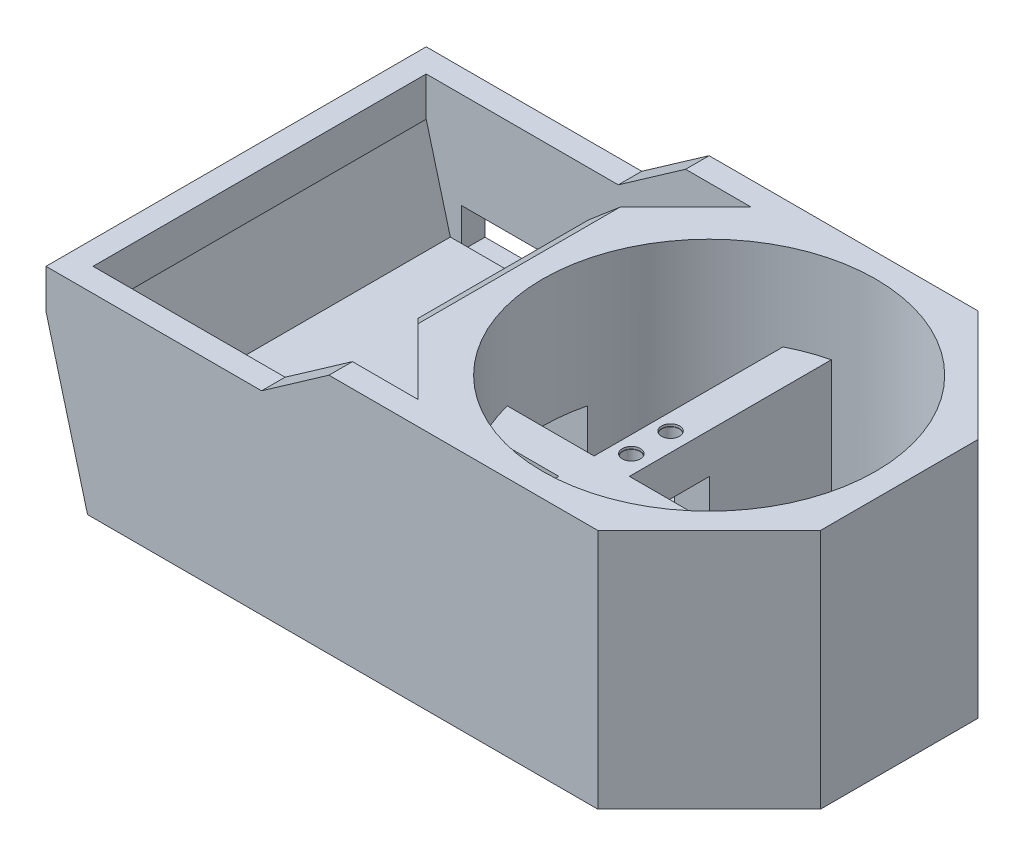
from build123d import *

# Parameters (mm, degrees)
BOSS_EXTRUDE1_DEPTH                          = 61.6
BOSS_EXTRUDE3_DEPTH                          = 97.007351
SKETCH3_R                                    = 42.5
CUT_EXTRUDE1_DEPTH                           = 53.5
BOSS_EXTRUDE2_START                          = 8.1
BOSS_EXTRUDE2_DEPTH                          = 31.22
CBORE_FOR_M5_HEX_HEAD_CAP_SCREW1_D           = 4.4
CBORE_FOR_M5_HEX_HEAD_CAP_SCREW1_DEPTH       = 5.5
CBORE_FOR_M5_HEX_HEAD_CAP_SCREW1_CBORE_D     = 4.6
CBORE_FOR_M5_HEX_HEAD_CAP_SCREW1_CBORE_DEPTH = 0.6
CBORE_FOR_M5_HEX_HEAD_CAP_SCREW1_TIP         = 1.321893362
CUT_EXTRUDE3_DEPTH                           = 45
BOSS_EXTRUDE4_REACH                          = 168.648
CUT_EXTRUDE2_REACH                           = 130.328
SKETCH6_W                                    = 20.5
SKETCH6_H                                    = 21
CUT_EXTRUDE2_DIRECTION_2_DEPTH               = 40
SKETCH13_W                                   = 20
SKETCH13_H                                   = 10
CUT_EXTRUDE4_DEPTH                           = 6


with BuildPart() as part:
    # Sketch1 → Boss-Extrude1 (new body)
    with BuildSketch(Plane(origin=(0, 0, 0), x_dir=(1, 0, 0), z_dir=(0, 1, 0))):
        Polygon((-48.503675457, 20.090880199), (-48.503675457, -20.090880199), (-20.090880199, -48.503675457), (20.090880199, -48.503675457), (48.503675457, -20.090880199), (48.503675457, 20.090880199), (20.090880199, 48.503675457), (-20.090880199, 48.503675457), align=None)
    extrude(amount=BOSS_EXTRUDE1_DEPTH)

    # Sketch10 → Boss-Extrude3 (add, through all)
    with BuildSketch(Plane.XY.offset(48.503675457)):
        Polygon((-20.090880199, 0), (-110.090880199, 0), (-120.692155197, 39.564496916), (-120.692155197, 49.564496916), (-65.692155197, 49.564496916), (-48.503675457, 61.6), (-20.090880199, 61.6), align=None)
    extrude(amount=-BOSS_EXTRUDE3_DEPTH)

    # Sketch3 → Cut-Extrude1 (cut)
    with BuildSketch(Plane(origin=(0, 61.6, 0), x_dir=(1, 0, 0), z_dir=(0, 1, 0))):
        with Locations(Location((0, 0, 0), (0, 0, 270))):
            Circle(SKETCH3_R)
    extrude(amount=-CUT_EXTRUDE1_DEPTH, mode=Mode.SUBTRACT)

    # Sketch5 → Boss-Extrude2 (add)
    with BuildSketch(Plane(origin=(0, 0, 0), x_dir=(1, 0, 0), z_dir=(0, 1, 0)).offset(BOSS_EXTRUDE2_START)):
        Polygon((41.245454295, -10.25), (38.9, -10.25), (38.9, 29.694555656), (29.9, 29.694555656), (29.9, -10.25), (-10.1, -10.25), (-10.1, 41.282441788), (-19.1, 41.282441788), (-19.1, -10.25), (-41.245454295, -10.25), (-41.245454295, -19.25), (-19.1, -19.25), (-19.1, -41.282441788), (-10.1, -41.282441788), (-10.1, -19.25), (29.9, -19.25), (29.9, -29.694555656), (38.9, -29.694555656), (38.9, -19.25), (41.245454295, -19.25), align=None)
    extrude(amount=BOSS_EXTRUDE2_DEPTH)

    # CBORE for M5 Hex Head Cap Screw1
    with Locations(Plane(origin=(0, 39.32, 0), x_dir=(1, 0, 0), z_dir=(0, 1, 0))):
        with Locations((-14.85, -5), (-14.85, 5), (34.65, 5), (34.65, -5)):
            CounterBoreHole(CBORE_FOR_M5_HEX_HEAD_CAP_SCREW1_D / 2, CBORE_FOR_M5_HEX_HEAD_CAP_SCREW1_CBORE_D / 2, CBORE_FOR_M5_HEX_HEAD_CAP_SCREW1_CBORE_DEPTH, depth=CBORE_FOR_M5_HEX_HEAD_CAP_SCREW1_DEPTH)
            with Locations((0, 0, -(CBORE_FOR_M5_HEX_HEAD_CAP_SCREW1_DEPTH + CBORE_FOR_M5_HEX_HEAD_CAP_SCREW1_TIP / 2))):  # 118° drill point
                Cone(0, CBORE_FOR_M5_HEX_HEAD_CAP_SCREW1_D / 2, CBORE_FOR_M5_HEX_HEAD_CAP_SCREW1_TIP, mode=Mode.SUBTRACT)

    # Sketch11 → Cut-Extrude3 (cut)
    with BuildSketch(Plane(origin=(0, 61.6, 0), x_dir=(1, 0, 0), z_dir=(0, 1, 0))):
        Polygon((-52.5, 21.746212025), (-52.5, -21.746212025), (-31.742536568, -42.503675457), (-114.692155197, -42.503675457), (-114.692155197, 42.503675457), (-31.742536568, 42.503675457), align=None)
    extrude(amount=-CUT_EXTRUDE3_DEPTH, mode=Mode.SUBTRACT)

    # Sketch12 → Boss-Extrude4 (add, up to next)
    with BuildSketch(Plane.XY.offset(48.503675457), mode=Mode.PRIVATE) as boss_extrude4_sk1:
        Polygon((-110.090880199, 0), (-104.090880199, 0), (-114.692155197, 39.564496916), (-120.692155197, 39.564496916), align=None)
    boss_extrude4_tool1 = extrude(boss_extrude4_sk1.sketch, amount=-BOSS_EXTRUDE4_REACH, mode=Mode.PRIVATE) - part.part
    add(boss_extrude4_tool1.solids().sort_by_distance((-112.391518, 19.782248, 48.503675))[0])

    # Sketch6 → Cut-Extrude2 (cut, up to next)
    with BuildSketch(Plane.ZY.offset(19.1), mode=Mode.PRIVATE) as cut_extrude2_sk1:
        with Locations((0, 18.6)):
            Rectangle(SKETCH6_W, SKETCH6_H)
    cut_extrude2_tool1 = extrude(cut_extrude2_sk1.sketch, amount=-CUT_EXTRUDE2_REACH, mode=Mode.PRIVATE) & part.part
    add(cut_extrude2_tool1.solids().sort_by_distance((-19.1, 18.6, 0))[0], mode=Mode.SUBTRACT)

    # Sketch6 → Cut-Extrude2 direction 2 (cut)
    with BuildSketch(Plane.ZY.offset(19.1)):
        with Locations((0, 18.6)):
            Rectangle(SKETCH6_W, SKETCH6_H)
    extrude(amount=CUT_EXTRUDE2_DIRECTION_2_DEPTH, mode=Mode.SUBTRACT)

    # Sketch13 → Cut-Extrude4 (cut)
    with BuildSketch(Plane(origin=(0, 0, -48.503675457), x_dir=(-1, 0, 0), z_dir=(0, 0, -1))):
        with Locations((95.692155197, 20)):
            Rectangle(SKETCH13_W, SKETCH13_H)
    extrude(amount=-CUT_EXTRUDE4_DEPTH, mode=Mode.SUBTRACT)


solid = part.part
